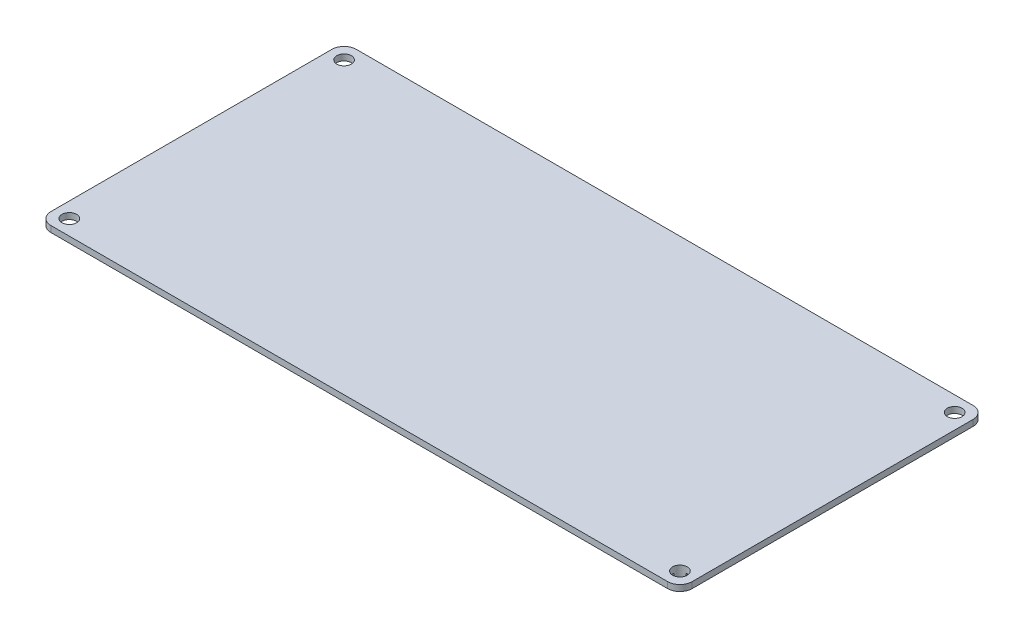
from build123d import *

# Parameters (mm, degrees)
SKETCH2_W           = 127
SKETCH2_H           = 57.15
BOSS_EXTRUDE3_DEPTH = 1.27
SKETCH3_W           = 133.35
SKETCH3_H           = 63.5
BOSS_EXTRUDE4_DEPTH = 1.27
SKETCH4_R           = 1.524
CUT_EXTRUDE1_DEPTH  = 74.892284611
FILLET1_R           = 2.54
SKETCH5_W           = 127
SKETCH5_H           = 57.15
SKETCH5_W_2         = 126.5428
SKETCH5_H_2         = 56.6928
CUT_EXTRUDE2_DEPTH  = 1.27


with BuildPart() as part:
    # Sketch2 → Boss-Extrude3 (new body)
    with BuildSketch(Plane(origin=(0, 0, 0), x_dir=(1, 0, 0), z_dir=(0, 1, 0))):
        Rectangle(SKETCH2_W, SKETCH2_H)
    extrude(amount=BOSS_EXTRUDE3_DEPTH)

    # Sketch3 → Boss-Extrude4 (add)
    with BuildSketch(Plane(origin=(0, 1.27, 0), x_dir=(1, 0, 0), z_dir=(0, 1, 0))):
        Rectangle(SKETCH3_W, SKETCH3_H)
    extrude(amount=BOSS_EXTRUDE4_DEPTH)

    # Sketch4 → Cut-Extrude1 (cut, through all)
    with BuildSketch(Plane(origin=(0, 0, 0), x_dir=(-1, 0, 0), z_dir=(0, -1, 0))):
        with Locations(Location((63.5, -28.575, 0), (0, 0, 90))):
            Circle(SKETCH4_R)
        with Locations(Location((-63.5, -28.575, 0), (0, 0, 90))):
            Circle(SKETCH4_R)
        with Locations(Location((-63.5, 28.575, 0), (0, 0, 90))):
            Circle(SKETCH4_R)
        with Locations(Location((63.5, 28.575, 0), (0, 0, 90))):
            Circle(SKETCH4_R)
    extrude(amount=-CUT_EXTRUDE1_DEPTH, mode=Mode.SUBTRACT)

    # Fillet1
    fillet1_edges = [part.edges().sort_by_distance(p)[0] for p in [
        (66.675, 1.905, 31.75),
        (66.675, 1.905, -31.75),
        (-66.675, 1.905, -31.75),
        (-66.675, 1.905, 31.75),
    ]]
    fillet(fillet1_edges, radius=FILLET1_R)

    # Sketch5 → Cut-Extrude2 (cut)
    with BuildSketch(Plane(origin=(0, 0, 0), x_dir=(-1, 0, 0), z_dir=(0, -1, 0))):
        Rectangle(SKETCH5_W, SKETCH5_H)
        Rectangle(SKETCH5_W_2, SKETCH5_H_2, mode=Mode.SUBTRACT)
    extrude(amount=-CUT_EXTRUDE2_DEPTH, mode=Mode.SUBTRACT)


solid = part.part
